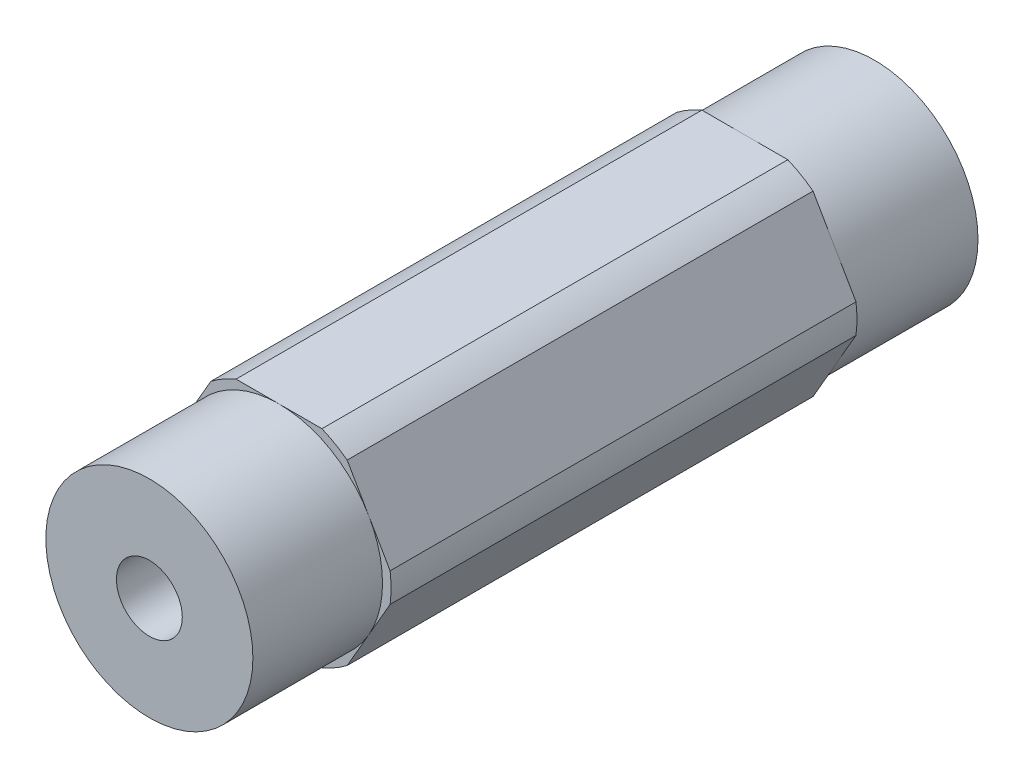
from build123d import *

# Parameters (mm, degrees)
BOSS_EXTRUDE1_DEPTH = 22.2377
SKETCH2_OUTSIDE_W   = 26.368
SKETCH2_OUTSIDE_H   = 24.404
SKETCH2_OUTSIDE_R   = 6.35
CUT_EXTRUDE2_DEPTH  = 7.9502
SKETCH3_OUTSIDE_W   = 26.368
SKETCH3_OUTSIDE_H   = 24.404
SKETCH3_OUTSIDE_R   = 6.875
CUT_EXTRUDE4_DEPTH  = 46.520841803
SKETCH4_R           = 2.0193
CUT_EXTRUDE5_DEPTH  = 46.44941507


with BuildPart() as part:
    # Sketch1 → Boss-Extrude1 (new, symmetric)
    with BuildSketch(Plane.XY):
        Polygon((7.332348419, 0), (3.666174209, 6.35), (-3.666174209, 6.35), (-7.332348419, 0), (-3.666174209, -6.35), (3.666174209, -6.35), align=None)
    extrude(amount=BOSS_EXTRUDE1_DEPTH, both=True)

    # Sketch2 outside → Cut-Extrude2 (cut)
    with BuildSketch(Plane.XY.offset(22.2377)):
        Rectangle(SKETCH2_OUTSIDE_W, SKETCH2_OUTSIDE_H)
        Circle(SKETCH2_OUTSIDE_R, mode=Mode.SUBTRACT)
    cut_extrude2 = extrude(amount=-CUT_EXTRUDE2_DEPTH, mode=Mode.SUBTRACT)

    # Mirror1: Cut-Extrude2 across plane
    add(cut_extrude2.mirror(Plane.XY), mode=Mode.SUBTRACT)

    # Sketch3 outside → Cut-Extrude4 (cut, through all)
    with BuildSketch(Plane.XY.offset(22.2377)):
        Rectangle(SKETCH3_OUTSIDE_W, SKETCH3_OUTSIDE_H)
        Circle(SKETCH3_OUTSIDE_R, mode=Mode.SUBTRACT)
    extrude(amount=-CUT_EXTRUDE4_DEPTH, mode=Mode.SUBTRACT)

    # Sketch4 → Cut-Extrude5 (cut, through all)
    with BuildSketch(Plane.XY.offset(22.2377)):
        Circle(SKETCH4_R)
    extrude(amount=-CUT_EXTRUDE5_DEPTH, mode=Mode.SUBTRACT)


solid = part.part
